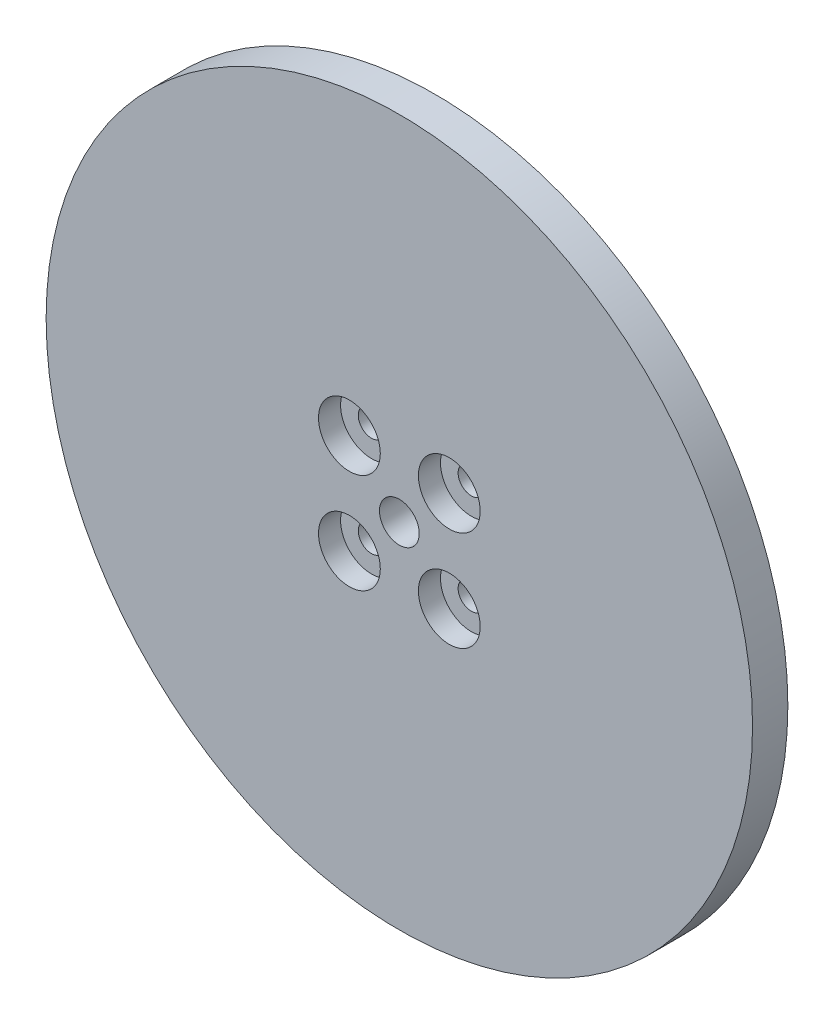
from build123d import *

# Parameters (mm, degrees)
SKETCH1_R           = 25
SKETCH1_R_2         = 12.5
BOSS_EXTRUDE1_DEPTH = 2.5
SKETCH2_R           = 40
SKETCH2_R_2         = 2.25
SKETCH2_R_3         = 1.5
BOSS_EXTRUDE2_DEPTH = 4
SKETCH3_R           = 3.5
CUT_EXTRUDE1_DEPTH  = 2.5


with BuildPart() as part:
    # Sketch1 → Boss-Extrude1 (new body)
    with BuildSketch(Plane.XY):
        Circle(SKETCH1_R)
        Circle(SKETCH1_R_2, mode=Mode.SUBTRACT)
    extrude(amount=BOSS_EXTRUDE1_DEPTH)

    # Sketch2 → Boss-Extrude2 (add)
    with BuildSketch(Plane.XY.offset(2.5)):
        Circle(SKETCH2_R)
        Circle(SKETCH2_R_2, mode=Mode.SUBTRACT)
        with Locations((-5.655999742, 5.657708628)):
            Circle(SKETCH2_R_3, mode=Mode.SUBTRACT)
        with Locations((-5.655999742, -5.657708628)):
            Circle(SKETCH2_R_3, mode=Mode.SUBTRACT)
        with Locations((5.655999742, -5.657708628)):
            Circle(SKETCH2_R_3, mode=Mode.SUBTRACT)
        with Locations((5.655999742, 5.657708628)):
            Circle(SKETCH2_R_3, mode=Mode.SUBTRACT)
    extrude(amount=BOSS_EXTRUDE2_DEPTH)

    # Sketch3 → Cut-Extrude1 (cut)
    with BuildSketch(Plane.XY.offset(6.5)):
        with Locations((-5.655999742, 5.657708628)):
            Circle(SKETCH3_R)
        with Locations((5.655999742, 5.657708628)):
            Circle(SKETCH3_R)
        with Locations((5.655999742, -5.657708628)):
            Circle(SKETCH3_R)
        with Locations((-5.655999742, -5.657708628)):
            Circle(SKETCH3_R)
    extrude(amount=-CUT_EXTRUDE1_DEPTH, mode=Mode.SUBTRACT)


solid = part.part
